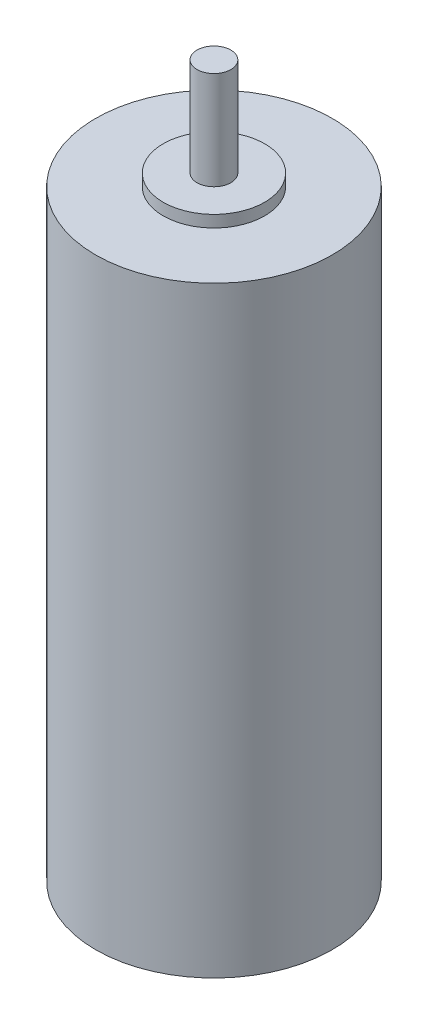
from build123d import *

# Parameters (mm, degrees)
SKETCH1_R           = 7
BOSS_EXTRUDE1_DEPTH = 35.6
SKETCH2_R           = 3
BOSS_EXTRUDE2_DEPTH = 0.7
SKETCH4_R           = 1
BOSS_EXTRUDE3_DEPTH = 6.5


with BuildPart() as part:
    # Sketch1 → Boss-Extrude1 (new body)
    with BuildSketch(Plane(origin=(0, 0, 0), x_dir=(1, 0, 0), z_dir=(0, 1, 0))):
        with Locations(Location((0, 0, 0), (0, 0, 270))):
            Circle(SKETCH1_R)
    extrude(amount=BOSS_EXTRUDE1_DEPTH)

    # Sketch2 → Boss-Extrude2 (add)
    with BuildSketch(Plane(origin=(0, 35.6, 0), x_dir=(1, 0, 0), z_dir=(0, 1, 0))):
        with Locations(Location((0, 0, 0), (0, 0, 270))):
            Circle(SKETCH2_R)
    extrude(amount=BOSS_EXTRUDE2_DEPTH)

    # Sketch4 → Boss-Extrude3 (add)
    with BuildSketch(Plane(origin=(0, 35.6, 0), x_dir=(1, 0, 0), z_dir=(0, 1, 0))):
        with Locations(Location((0, 0, 0), (0, 0, 90))):
            Circle(SKETCH4_R)
    extrude(amount=BOSS_EXTRUDE3_DEPTH)


solid = part.part
